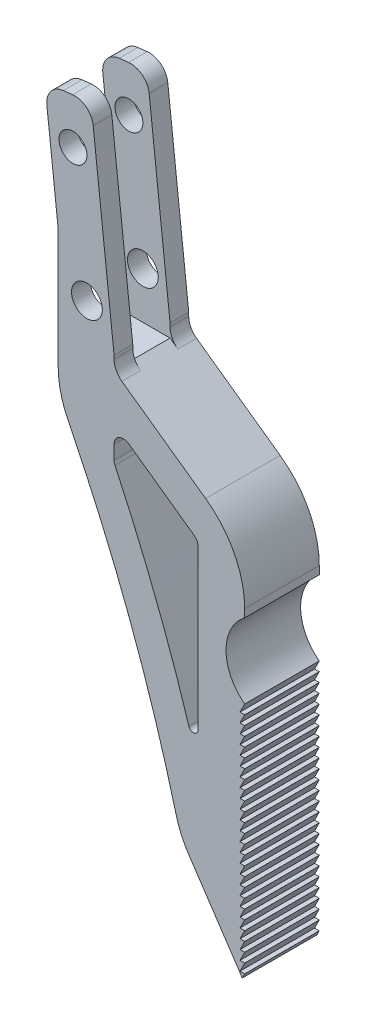
from build123d import *

# Parameters (mm, degrees)
BOSS_EXTRUDE1_DEPTH     = 4
SKETCH2_W               = 20
SKETCH2_H               = 25
CUT_EXTRUDE1_DEPTH      = 2
CUT_EXTRUDE2_DEPTH      = 78.013058248
CUT_EXTRUDE2_DEPTH_BACK = 78.013058248
CUT_EXTRUDE3_DEPTH      = 78.013058248
LPATTERN1_COUNT         = 26
LPATTERN1_PITCH         = 1.0025
CUT_EXTRUDE4_DEPTH      = 78.013058248
CUT_EXTRUDE5_DEPTH      = 78.013058248
FILLET1_R               = 10
FILLET2_R               = 2
FILLET3_R               = 1
FILLET4_R               = 0.5
SKETCH9_R               = 1.5
SKETCH9_R_2             = 1.652612025
CUT_EXTRUDE6_DEPTH      = 77.755921087


with BuildPart() as part:
    # Sketch1 → Boss-Extrude1 (new, symmetric)
    with BuildSketch(Plane.XY):
        Polygon((0, 0), (-20, 29.933259094), (-20, 60.063259094), (-21.435566599, 72.983752449), (-16.466146078, 73.535893449), (-14.000284373, 51.342461401), (-14.000284373, 49.942461401), (0, 39.956155609), align=None)
    extrude(amount=BOSS_EXTRUDE1_DEPTH, both=True)

    # Sketch2 → Cut-Extrude1 (cut, symmetric)
    with BuildSketch(Plane.XY):
        with Locations((-24.000284373, 62.442461401)):
            Rectangle(SKETCH2_W, SKETCH2_H)
    extrude(amount=CUT_EXTRUDE1_DEPTH, both=True, mode=Mode.SUBTRACT)

    # Sketch3 → Cut-Extrude2 (cut, two sides: drawn at the far end of the back side and taken through both)
    with BuildSketch(Plane.XY.offset(4).offset(-CUT_EXTRUDE2_DEPTH_BACK)):
        with BuildLine():
            Line((91.496624596, 102.578624056), (0, 33.956155609))
            ThreePointArc((0, 33.956155609), (-2, 29.956155609), (0, 25.956155609))
            Line((0, 25.956155609), (91.496624596, -42.666312838))
            Line((91.496624596, -42.666312838), (320.238186086, -42.666312838))
            Line((320.238186086, -42.666312838), (320.238186086, 102.578624056))
            Line((320.238186086, 102.578624056), (91.496624596, 102.578624056))
        make_face()
    extrude(amount=CUT_EXTRUDE2_DEPTH + CUT_EXTRUDE2_DEPTH_BACK, mode=Mode.SUBTRACT)

    # Sketch4 → Cut-Extrude3 (cut, symmetric)
    with BuildSketch(Plane.XY.offset(4)):
        Polygon((51.965078117, 129.886311843), (0, 25.956155609), (-0.5, 24.956155609), (0, 24.956155609), (116.197447126, 24.956155609), (314.404638126, 146.287504856), (250.172269117, 251.21766109), align=None)
    cut_extrude3 = extrude(amount=CUT_EXTRUDE3_DEPTH, both=True, mode=Mode.SUBTRACT)

    # LPattern1: Cut-Extrude3 ×26
    with Locations(*[(0, -i * LPATTERN1_PITCH, 0) for i in range(1, LPATTERN1_COUNT)]):
        add(cut_extrude3, mode=Mode.SUBTRACT)

    # Sketch5 → Cut-Extrude4 (cut, through all)
    with BuildSketch(Plane.XY.offset(4)):
        with BuildLine():
            Line((-20, 44.933259094), (-20, 29.933259094))
            Line((-20, 29.933259094), (-6.933333333, 10.376863153))
            ThreePointArc((-6.933333333, 10.376863153), (-12.465928354, 28.033466151), (-20, 44.933259094))
        make_face()
    extrude(amount=-CUT_EXTRUDE4_DEPTH, mode=Mode.SUBTRACT)

    # Sketch6 → Cut-Extrude5 (cut, through all)
    with BuildSketch(Plane.XY.offset(4)):
        with BuildLine():
            Line((-14.004117633, 45.031887994), (-5, 38.609313304))
            Line((-5, 38.609313304), (-5, 17.671887994))
            ThreePointArc((-5, 17.671887994), (-9.031897039, 29.700512127), (-14.004117633, 41.371887994))
            Line((-14.004117633, 41.371887994), (-14.004117633, 45.031887994))
        make_face()
    extrude(amount=-CUT_EXTRUDE5_DEPTH, mode=Mode.SUBTRACT)

    # Fillet1
    fillet1_edges = [part.edges().sort_by_distance(p)[0] for p in [
        (0, 39.956155609, 0),
        (-20, 44.933259094, 0),
        (-6.933333333, 10.376863153, 0),
    ]]
    fillet(fillet1_edges, radius=FILLET1_R)

    # Fillet2
    fillet2_edges = [part.edges().sort_by_distance(p)[0] for p in [
        (-21.435566599, 72.983752449, 3),
        (-16.466146078, 73.535893449, 3),
        (-14.000284373, 49.942461401, 3),
        (-21.435566599, 72.983752449, -3),
        (-16.466146078, 73.535893449, -3),
        (-14.000284373, 49.942461401, -3),
    ]]
    fillet(fillet2_edges, radius=FILLET2_R)

    # Fillet3
    fillet3_edges = [part.edges().sort_by_distance(p)[0] for p in [
        (-14.004117633, 41.371887994, 0),
        (-14.004117633, 45.031887994, 0),
        (-5, 38.609313304, 0),
    ]]
    fillet(fillet3_edges, radius=FILLET3_R)

    # Fillet4
    fillet4_edges = [part.edges().sort_by_distance(p)[0] for p in [
        (-5, 17.671887994, 0),
    ]]
    fillet(fillet4_edges, radius=FILLET4_R)

    # Sketch9 → Cut-Extrude6 (cut, through all)
    with BuildSketch(Plane.XY.offset(4)):
        with Locations((-18.416383851, 68.449423885)):
            Circle(SKETCH9_R)
        with Locations((-16.915664614, 54.942538908)):
            Circle(SKETCH9_R_2)
    extrude(amount=-CUT_EXTRUDE6_DEPTH, mode=Mode.SUBTRACT)


solid = part.part
